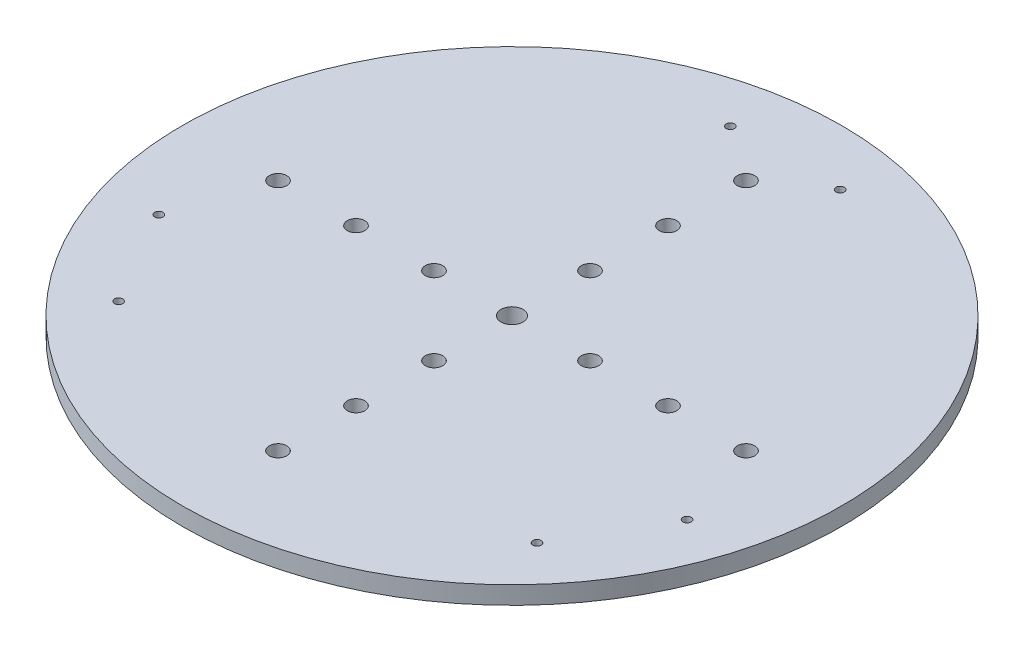
from build123d import *

# Parameters (mm, degrees)
CROQUIS1_R              = 120
SALIENTE_EXTRUIR1_DEPTH = 6.5
CROQUIS2_R              = 4
CORTAR_EXTRUIR1_DEPTH   = 6.5
CROQUIS3_R              = 3.175
CORTAR_EXTRUIR2_DEPTH   = 6.5
CROQUIS4_R              = 1.5
CORTAR_EXTRUIR3_DEPTH   = 10


with BuildPart() as part:
    # Croquis1 → Saliente-Extruir1 (new body)
    with BuildSketch(Plane(origin=(0, 0, 0), x_dir=(1, 0, 0), z_dir=(0, 1, 0))):
        with Locations(Location((0, 0, 0), (0, 0, 270))):
            Circle(CROQUIS1_R)
    extrude(amount=SALIENTE_EXTRUIR1_DEPTH)

    # Croquis2 → Cortar-Extruir1 (cut)
    with BuildSketch(Plane(origin=(0, 6.5, 0), x_dir=(1, 0, 0), z_dir=(0, 1, 0))):
        with Locations(Location((0, 0, 0), (0, 0, 270))):
            Circle(CROQUIS2_R)
    extrude(amount=-CORTAR_EXTRUIR1_DEPTH, mode=Mode.SUBTRACT)

    # Croquis3 → Cortar-Extruir2 (cut)
    with BuildSketch(Plane(origin=(0, 0, 0), x_dir=(-1, 0, 0), z_dir=(0, -1, 0))):
        with Locations(Location((-28.4, 0, 0), (0, 0, 90))):
            Circle(CROQUIS3_R)
        with Locations(Location((-56.8, 0, 0), (0, 0, 90))):
            Circle(CROQUIS3_R)
        with Locations(Location((-85.2, 0, 0), (0, 0, 90))):
            Circle(CROQUIS3_R)
        with Locations(Location((85.2, 0, 0), (0, 0, 270))):
            Circle(CROQUIS3_R)
        with Locations(Location((56.8, 0, 0), (0, 0, 270))):
            Circle(CROQUIS3_R)
        with Locations(Location((28.4, 0, 0), (0, 0, 270))):
            Circle(CROQUIS3_R)
        with Locations(Location((0, -28.4, 0), (0, 0, 90))):
            Circle(CROQUIS3_R)
        with Locations(Location((0, -56.8, 0), (0, 0, 90))):
            Circle(CROQUIS3_R)
        with Locations(Location((0, -85.2, 0), (0, 0, 90))):
            Circle(CROQUIS3_R)
        with Locations(Location((0, 85.2, 0), (0, 0, 270))):
            Circle(CROQUIS3_R)
        with Locations(Location((0, 56.8, 0), (0, 0, 270))):
            Circle(CROQUIS3_R)
        with Locations(Location((0, 28.4, 0), (0, 0, 270))):
            Circle(CROQUIS3_R)
    extrude(amount=-CORTAR_EXTRUIR2_DEPTH, mode=Mode.SUBTRACT)

    # Croquis4 → Cortar-Extruir3 (cut)
    with BuildSketch(Plane.XZ):
        with Locations(Location((20, -99.505571576, 0), (0, 0, 270))):
            Circle(CROQUIS4_R)
        with Locations(Location((-20, -99.505571576, 0), (0, 0, 90))):
            Circle(CROQUIS4_R)
        with Locations(Location((-96.174352803, 32.432277712, 0), (0, 0, 270))):
            Circle(CROQUIS4_R)
        with Locations(Location((-76.174352803, 67.073293864, 0), (0, 0, 90))):
            Circle(CROQUIS4_R)
        with Locations(Location((76.174352803, 67.073293864, 0), (0, 0, 270))):
            Circle(CROQUIS4_R)
        with Locations(Location((96.174352803, 32.432277712, 0), (0, 0, 90))):
            Circle(CROQUIS4_R)
    extrude(amount=-CORTAR_EXTRUIR3_DEPTH, mode=Mode.SUBTRACT)


solid = part.part
